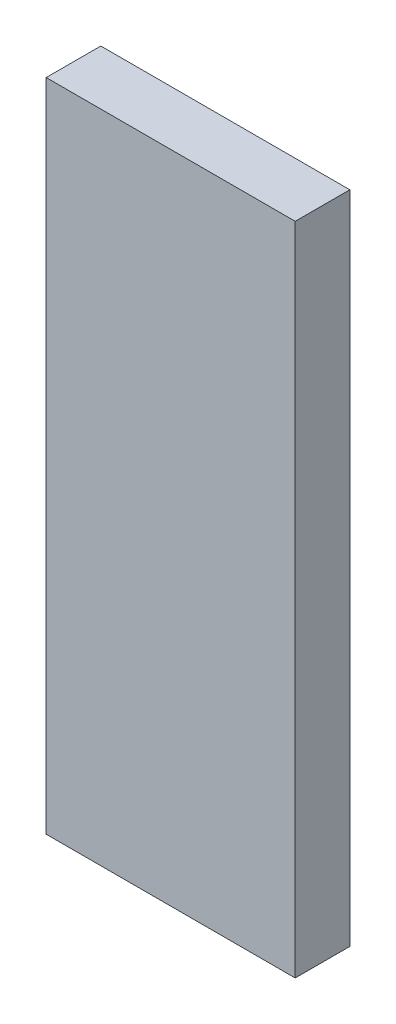
from build123d import *

# Parameters (mm, degrees)
SKETCH1_W           = 14.478
SKETCH1_H           = 38.1
BOSS_EXTRUDE1_DEPTH = 3.175


with BuildPart() as part:
    # Sketch1 → Boss-Extrude1 (new body)
    with BuildSketch(Plane.XY):
        with Locations((7.239, 19.05)):
            Rectangle(SKETCH1_W, SKETCH1_H)
    extrude(amount=BOSS_EXTRUDE1_DEPTH)


solid = part.part
